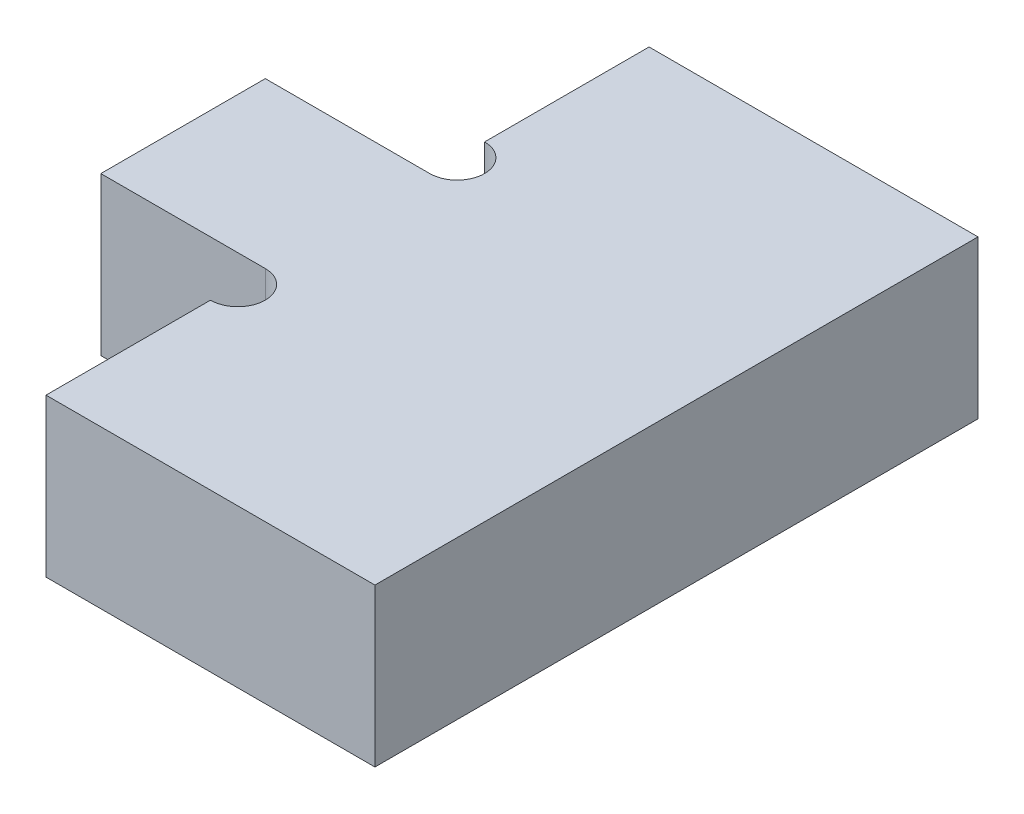
from build123d import *

# Parameters (mm, degrees)
BOSS_EXTRUDE1_DEPTH = 18.25625


with BuildPart() as part:
    # Sketch1 → Boss-Extrude1 (new body)
    with BuildSketch(Plane(origin=(0, 0, 0), x_dir=(1, 0, 0), z_dir=(0, 1, 0))):
        with BuildLine():
            Line((7.9375, 34.925), (7.9375, 15.875))
            ThreePointArc((7.9375, 15.875), (11.1125, 12.7), (7.9375, 9.525))
            Line((7.9375, 9.525), (-11.1125, 9.525))
            Line((-11.1125, 9.525), (-11.1125, -9.525))
            Line((-11.1125, -9.525), (7.9375, -9.525))
            ThreePointArc((7.9375, -9.525), (11.1125, -12.7), (7.9375, -15.875))
            Line((7.9375, -15.875), (7.9375, -34.925))
            Line((7.9375, -34.925), (46.0375, -34.925))
            Line((46.0375, -34.925), (46.0375, 34.925))
            Line((46.0375, 34.925), (7.9375, 34.925))
        make_face()
    extrude(amount=BOSS_EXTRUDE1_DEPTH)


solid = part.part
